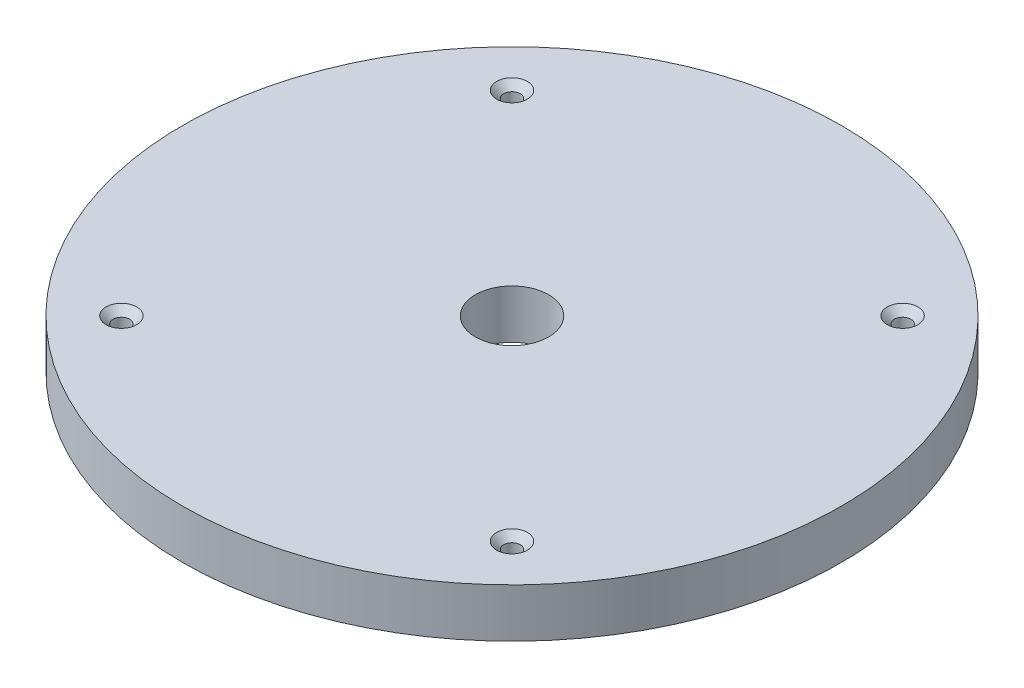
from build123d import *

# Parameters (mm, degrees)
SKETCH1_R                                           = 67.5
BOSS_EXTRUDE1_DEPTH                                 = 10
CSK_FOR_M3_COUNTERSUNK_FLAT_HEAD_SCREW1_D           = 3.4
CSK_FOR_M3_COUNTERSUNK_FLAT_HEAD_SCREW1_CSINK_D     = 6.3
CSK_FOR_M3_COUNTERSUNK_FLAT_HEAD_SCREW1_CSINK_ANGLE = 90
SKETCH5_R                                           = 7.5
CUT_EXTRUDE1_DEPTH                                  = 96.981769102


with BuildPart() as part:
    # Sketch1 → Boss-Extrude1 (new body)
    with BuildSketch(Plane(origin=(0, 0, 0), x_dir=(1, 0, 0), z_dir=(0, 1, 0))):
        with Locations(Location((0, 0, 0), (0, 0, 270))):
            Circle(SKETCH1_R)
    extrude(amount=BOSS_EXTRUDE1_DEPTH)

    # CSK for M3 Countersunk Flat Head Screw1 (through all)
    with Locations(Plane(origin=(0, 10, 0), x_dir=(1, 0, 0), z_dir=(0, 1, 0))):
        with Locations((-40, 40), (40, 40), (40, -40), (-40, -40)):
            CounterSinkHole(CSK_FOR_M3_COUNTERSUNK_FLAT_HEAD_SCREW1_D / 2, CSK_FOR_M3_COUNTERSUNK_FLAT_HEAD_SCREW1_CSINK_D / 2, counter_sink_angle=CSK_FOR_M3_COUNTERSUNK_FLAT_HEAD_SCREW1_CSINK_ANGLE)

    # Sketch5 → Cut-Extrude1 (cut, through all)
    with BuildSketch(Plane(origin=(0, 10, 0), x_dir=(1, 0, 0), z_dir=(0, 1, 0))):
        with Locations(Location((0, 0, 0), (0, 0, 270))):
            Circle(SKETCH5_R)
    extrude(amount=-CUT_EXTRUDE1_DEPTH, mode=Mode.SUBTRACT)


solid = part.part
